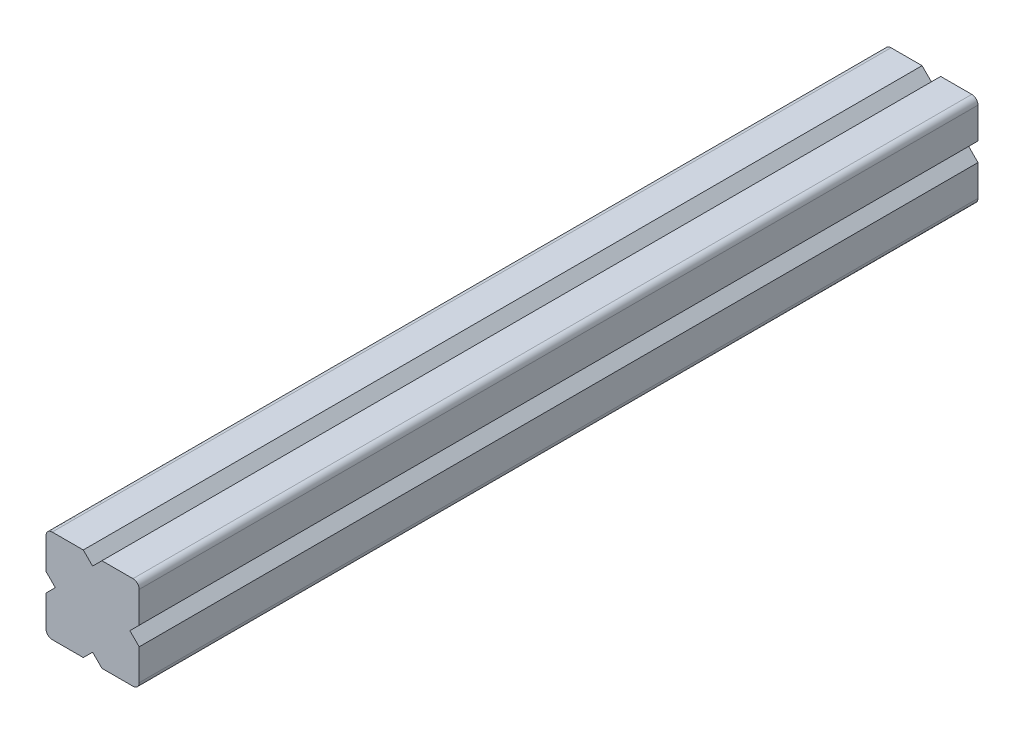
from build123d import *

# Parameters (mm, degrees)
EXTRUDE_1_DEPTH = 135


with BuildPart() as part:
    # 스케치1 → 보스-돌출1 (new, symmetric)
    with BuildSketch(Plane.XY):
        with BuildLine():
            Line((15, 3), (15, 13))
            ThreePointArc((15, 13), (14.414213562, 14.414213562), (13, 15))
            Line((13, 15), (3, 15))
            Line((3, 15), (0, 12))
            Line((0, 12), (-3, 15))
            Line((-3, 15), (-13, 15))
            ThreePointArc((-13, 15), (-14.414213562, 14.414213562), (-15, 13))
            Line((-15, 13), (-15, 3))
            Line((-15, 3), (-12, 0))
            Line((-12, 0), (-15, -3))
            Line((-15, -3), (-15, -13))
            ThreePointArc((-15, -13), (-14.414213562, -14.414213562), (-13, -15))
            Line((-13, -15), (-3, -15))
            Line((-3, -15), (0, -12))
            Line((0, -12), (3, -15))
            Line((3, -15), (13, -15))
            ThreePointArc((13, -15), (14.414213562, -14.414213562), (15, -13))
            Line((15, -13), (15, -3))
            Line((15, -3), (12, 0))
            Line((12, 0), (15, 3))
        make_face()
    extrude(amount=EXTRUDE_1_DEPTH, both=True)


solid = part.part
